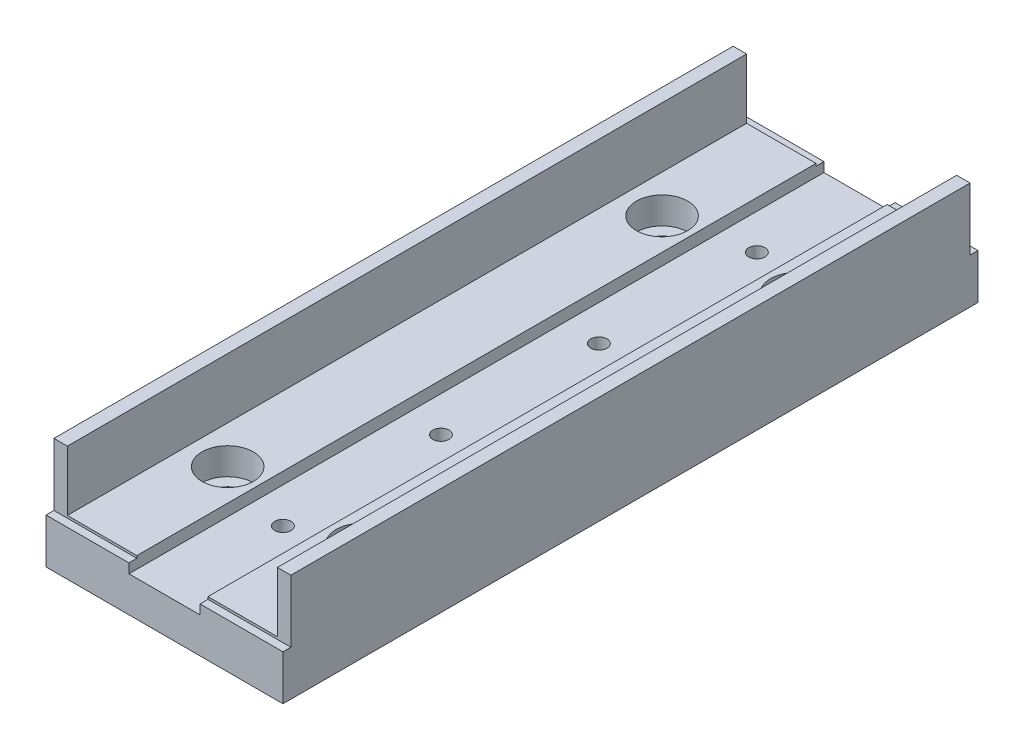
from build123d import *

# Parameters (mm, degrees)
BODY_DEPTH             = 88
SKETCH_2_W             = 30
SKETCH_2_H             = 1
CUT1_DEPTH             = 7.9
FIXTURE_M3_D           = 3.4
FIXTURE_M3_DEPTH       = 6
FIXTURE_M3_CBORE_D     = 6.5
FIXTURE_M3_CBORE_DEPTH = 3.4
FIXTURE_M3_TIP         = 1.021463052
PATTERN_LINEAR_1_COUNT = 4
PATTERN_LINEAR_1_PITCH = 20


with BuildPart() as part:
    # Эскиз1 → Body (new body)
    with BuildSketch(Plane.XY):
        Polygon((-15, -3), (15, -3), (15, 3), (15, 10.6), (13.3, 10.6), (13.3, 3), (4.5, 3), (4.5, 1.5), (-4.5, 1.5), (-4.5, 3), (-13.3, 3), (-13.3, 10.6), (-15, 10.6), (-15, 3), align=None)
    extrude(amount=BODY_DEPTH)

    # Эскиз2 → Cut1 (cut)
    with BuildSketch(Plane(origin=(0, 10.6, 0), x_dir=(1, 0, 0), z_dir=(0, 1, 0))):
        with Locations((0, -87.5)):
            Rectangle(SKETCH_2_W, SKETCH_2_H)
        with Locations((0, -0.5)):
            Rectangle(SKETCH_2_W, SKETCH_2_H)
    extrude(amount=-CUT1_DEPTH, mode=Mode.SUBTRACT)

    # Fixture M3
    with Locations(Plane(origin=(-8.5, 3, 71.5), x_dir=(1, 0, 0), z_dir=(0, 1, 0))):
        with Locations((0, 0), (17, 0), (17, 55), (0, 55)):
            CounterBoreHole(FIXTURE_M3_D / 2, FIXTURE_M3_CBORE_D / 2, FIXTURE_M3_CBORE_DEPTH, depth=FIXTURE_M3_DEPTH)
            with Locations((0, 0, -(FIXTURE_M3_DEPTH + FIXTURE_M3_TIP / 2))):  # 118° drill point
                Cone(0, FIXTURE_M3_D / 2, FIXTURE_M3_TIP, mode=Mode.SUBTRACT)

    # Эскиз7 → Fixture M2 (revolve, cut)
    with BuildSketch(Plane(origin=(0, 1.5, 73), x_dir=(0, 0, 1), z_dir=(1, 0, 0))):
        Polygon((0, 0), (0, 5.115882135), (1.025, 4.5), (1.025, 0), align=None)
    fixture_m2 = revolve(axis=Axis((0, 7.85, 73), (0, -1, 0)), mode=Mode.SUBTRACT)

    # Линейный массив1: Fixture M2 ×4
    with Locations(*[(0, 0, -i * PATTERN_LINEAR_1_PITCH) for i in range(1, PATTERN_LINEAR_1_COUNT)]):
        add(fixture_m2, mode=Mode.SUBTRACT)


solid = part.part
